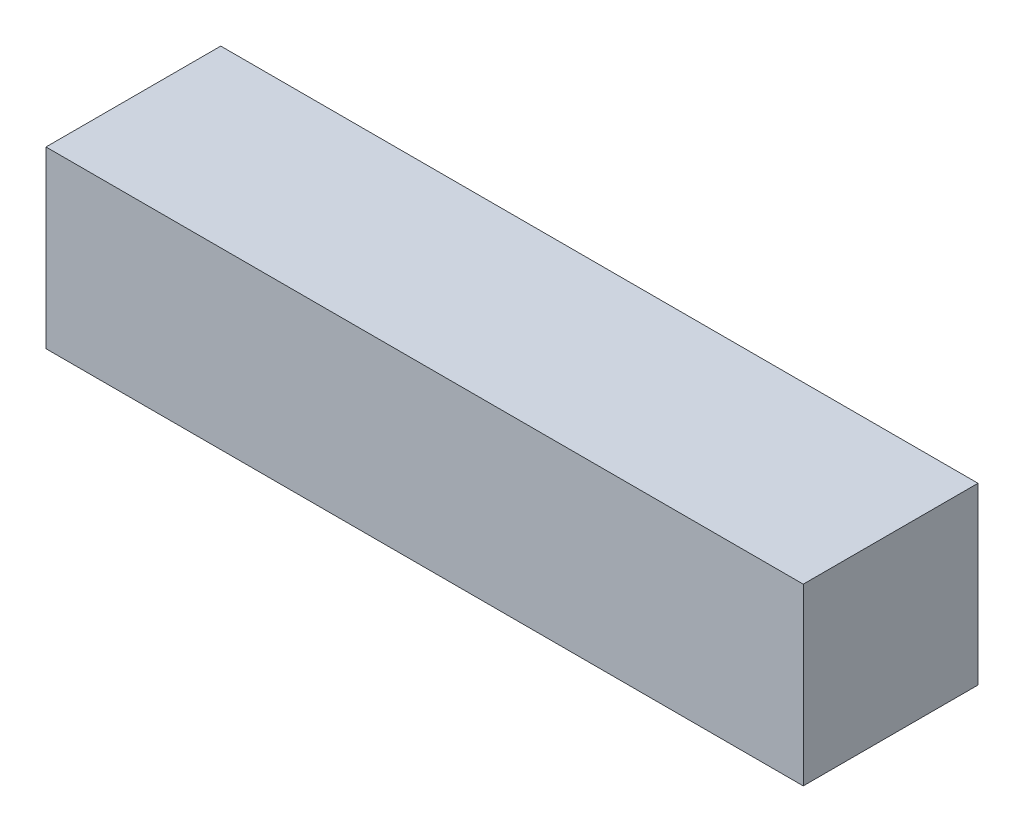
from build123d import *

# Parameters (mm, degrees)
SKETCH1_W           = 165.1
SKETCH1_H           = 38.1
BOSS_EXTRUDE1_DEPTH = 38.1


with BuildPart() as part:
    # Sketch1 → Boss-Extrude1 (new body)
    with BuildSketch(Plane.XY):
        Rectangle(SKETCH1_W, SKETCH1_H)
    extrude(amount=BOSS_EXTRUDE1_DEPTH)


solid = part.part
